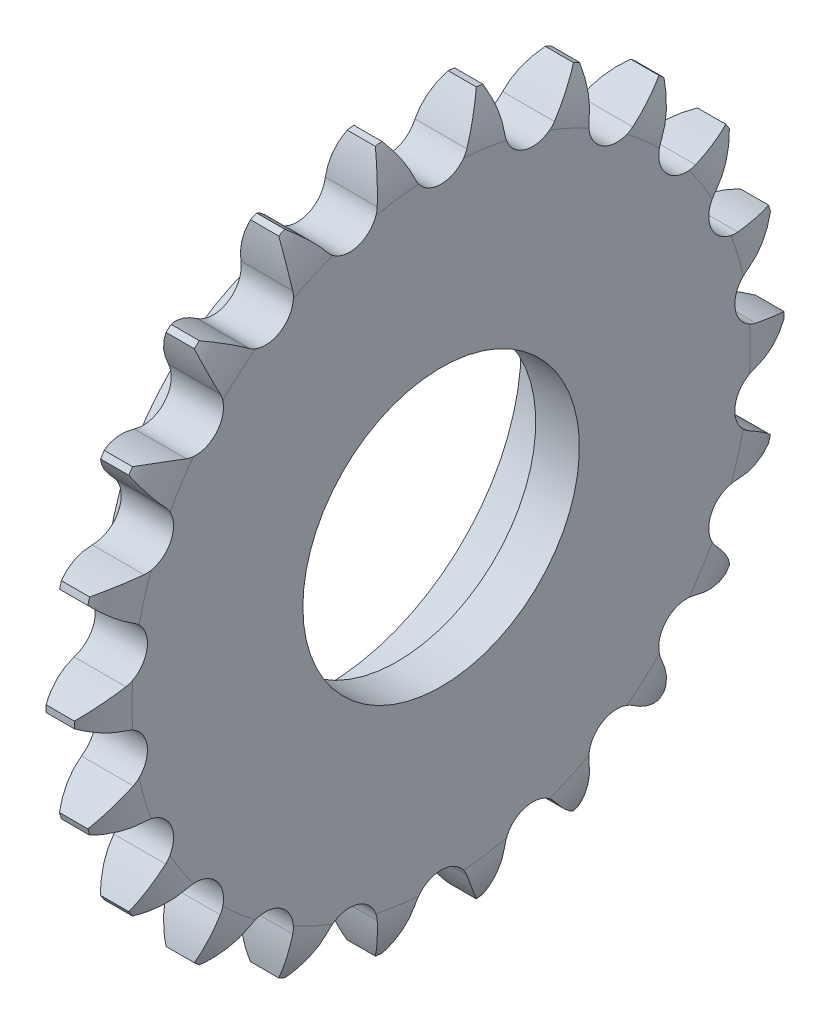
from build123d import *

# Parameters (mm, degrees)
TOOTHCUT_DEPTH           = 174.279519362
TEETHCUTS_COUNT          = 22
TEETHCUTS_ANGLE          = 343.636363636
HUBNEAONESKE_R           = 75
HUBNEARONE_DEPTH         = 22.0405
HUBNEARONEFILLET_R       = 0.8
BORSKE_R                 = 47.5
BORE_DEPTH               = 40.0005
SCHIZZO1_R               = 67.5
TAGLIO_ESTRUSIONE1_DEPTH = 25


with BuildPart() as part:
    # BasProSke → Base-Revolve (revolve)
    with BuildSketch(Plane(origin=(0, 0, 0), x_dir=(1, 0, 0), z_dir=(0, 1, 0)), mode=Mode.PRIVATE) as base_revolve_sk:
        with BuildLine():
            Line((0, 0), (0, 106.212810632))
            ThreePointArc((0, 106.212810632), (1.049211126, 114.30750411), (4.1275, 121.867202787))
            Line((4.1275, 121.867202787), (13.8325, 121.867202787))
            ThreePointArc((13.8325, 121.867202787), (16.910788874, 114.30750411), (17.96, 106.212810632))
            Line((17.96, 106.212810632), (17.96, 0))
            Line((17.96, 0), (0, 0))
        make_face()
    revolve(base_revolve_sk.sketch.rotate(Axis((-10, 0, 0), (1, 0, 0)), 180), axis=Axis((-10, 0, 0), (1, 0, 0)))

    # TooCutSke → ToothCut (cut, through all)
    with BuildSketch(Plane(origin=(0, 0, 0), x_dir=(0, 0, -1), z_dir=(1, 0, 0))):
        with BuildLine():
            ThreePointArc((8.916878655, 108.032818531), (12.27460072, 114.904322862), (16.55525159, 121.242137736))
            ThreePointArc((16.55525159, 121.242137736), (0, 122.367202787), (-16.55525159, 121.242137736))
            ThreePointArc((-16.55525159, 121.242137736), (-12.27460072, 114.904322862), (-8.916878655, 108.032818531))
            ThreePointArc((-8.916878655, 108.032818531), (0, 102.023452787), (8.916878655, 108.032818531))
        make_face()
    toothcut = extrude(amount=TOOTHCUT_DEPTH, mode=Mode.SUBTRACT)

    # TeethCuts: ToothCut ×22 about axis
    teethcuts_axis = Axis((-10, 0, 0), (1, 0, 0))
    for i in range(1, TEETHCUTS_COUNT):
        add(toothcut.rotate(teethcuts_axis, i * TEETHCUTS_ANGLE / (TEETHCUTS_COUNT - 1)), mode=Mode.SUBTRACT)

    # HubNeaOneSke → HubNearOne (add)
    with BuildSketch(Plane.ZY):
        with Locations(Location((0, 0, 0), (0, 0, 180))):
            Circle(HUBNEAONESKE_R)
    extrude(amount=HUBNEARONE_DEPTH)

    # HubNearOneFillet
    hubnearonefillet_edges = [part.edges().sort_by_distance(p)[0] for p in [
        (0, 0, 75),
    ]]
    fillet(hubnearonefillet_edges, radius=HUBNEARONEFILLET_R)

    # BorSke → Bore (cut, symmetric)
    with BuildSketch(Plane(origin=(0, 0, 0), x_dir=(0, 0, -1), z_dir=(1, 0, 0))):
        with Locations(Location((0, 0, 0), (0, 0, 180))):
            Circle(BORSKE_R)
    extrude(amount=BORE_DEPTH, both=True, mode=Mode.SUBTRACT)

    # Schizzo1 → Taglio-Estrusione1 (cut)
    with BuildSketch(Plane.ZY.offset(22.0405)):
        Circle(SCHIZZO1_R)
    extrude(amount=-TAGLIO_ESTRUSIONE1_DEPTH, mode=Mode.SUBTRACT)


solid = part.part
